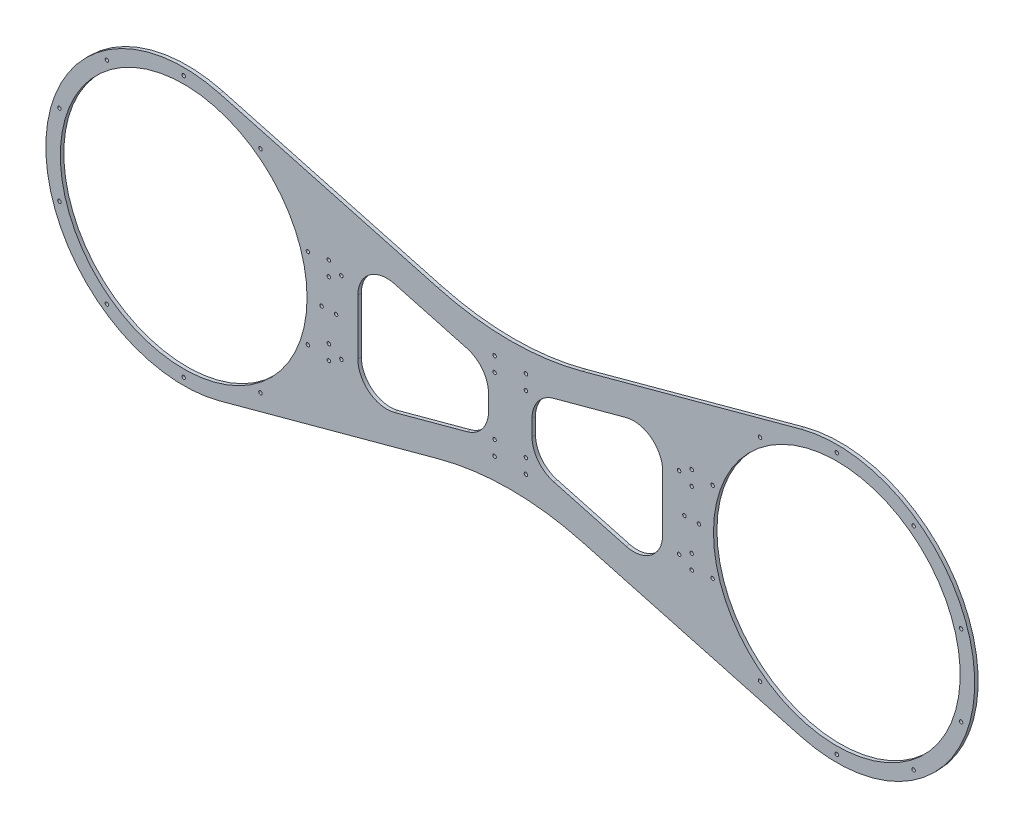
from build123d import *

# Parameters (mm, degrees)
SKETCH1_R           = 425
SKETCH1_R_2         = 6
BOSS_EXTRUDE1_DEPTH = 12
FILLET1_R           = 950
FILLET2_R           = 100


with BuildPart() as part:
    # Sketch1 → Boss-Extrude1 (new body)
    with BuildSketch(Plane.XY):
        with BuildLine():
            Line((-1000.859642854, 458.491190458), (0, 187.5))
            Line((0, 187.5), (0, -187.5))
            Line((0, -187.5), (-1000.859642854, -458.491190458))
            ThreePointArc((-1000.859642854, -458.491190458), (-1600, 0), (-1000.859642854, 458.491190458))
        make_face()
        with Locations((-1125, 0)):
            Circle(SKETCH1_R, mode=Mode.SUBTRACT)
        with Locations((-1125, 450)):
            Circle(SKETCH1_R_2, mode=Mode.SUBTRACT)
        with Locations((-860.496636468, 364.057647469)):
            Circle(SKETCH1_R_2, mode=Mode.SUBTRACT)
        with Locations((-697.024567667, 139.057647469)):
            Circle(SKETCH1_R_2, mode=Mode.SUBTRACT)
        with Locations((-697.024567667, -139.057647469)):
            Circle(SKETCH1_R_2, mode=Mode.SUBTRACT)
        with Locations((-860.496636468, -364.057647469)):
            Circle(SKETCH1_R_2, mode=Mode.SUBTRACT)
        with Locations((-1125, -450)):
            Circle(SKETCH1_R_2, mode=Mode.SUBTRACT)
        with Locations((-1389.503363532, -364.057647469)):
            Circle(SKETCH1_R_2, mode=Mode.SUBTRACT)
        with Locations((-1552.975432333, -139.057647469)):
            Circle(SKETCH1_R_2, mode=Mode.SUBTRACT)
        with Locations((-1552.975432333, 139.057647469)):
            Circle(SKETCH1_R_2, mode=Mode.SUBTRACT)
        with Locations((-1389.503363532, 364.057647469)):
            Circle(SKETCH1_R_2, mode=Mode.SUBTRACT)
        with Locations((-625, 150)):
            Circle(SKETCH1_R_2, mode=Mode.SUBTRACT)
        with Locations((-625, 100)):
            Circle(SKETCH1_R_2, mode=Mode.SUBTRACT)
        with Locations((-581.698729811, 125)):
            Circle(SKETCH1_R_2, mode=Mode.SUBTRACT)
        with Locations(Location((-625, -150, 0), (0, 0, 180))):
            Circle(SKETCH1_R_2, mode=Mode.SUBTRACT)
        with Locations(Location((-581.698729811, -125, 0), (0, 0, 180))):
            Circle(SKETCH1_R_2, mode=Mode.SUBTRACT)
        with Locations(Location((-625, -100, 0), (0, 0, 180))):
            Circle(SKETCH1_R_2, mode=Mode.SUBTRACT)
        with Locations((-600, 0)):
            Circle(SKETCH1_R_2, mode=Mode.SUBTRACT)
        with Locations((-650, 0)):
            Circle(SKETCH1_R_2, mode=Mode.SUBTRACT)
        with Locations((-54, 150)):
            Circle(SKETCH1_R_2, mode=Mode.SUBTRACT)
        with Locations((-54, 100)):
            Circle(SKETCH1_R_2, mode=Mode.SUBTRACT)
        with Locations(Location((-54, -150, 0), (0, 0, 180))):
            Circle(SKETCH1_R_2, mode=Mode.SUBTRACT)
        with Locations(Location((-54, -100, 0), (0, 0, 180))):
            Circle(SKETCH1_R_2, mode=Mode.SUBTRACT)
        Polygon((-75, 104.206200667), (-75, -104.206200667), (-525, -226.047496374), (-525, 226.047496374), align=None, mode=Mode.SUBTRACT)
    boss_extrude1 = extrude(amount=BOSS_EXTRUDE1_DEPTH)

    # Mirror1: Boss-Extrude1 across plane
    add(boss_extrude1.mirror(Plane(origin=(0, -187.5, 12), x_dir=(0, 0, 1), z_dir=(-1, 0, 0))))

    # Fillet1
    fillet1_edges = [part.edges().sort_by_distance(p)[0] for p in [
        (0, 187.5, 6),
        (0, -187.5, 6),
    ]]
    fillet(fillet1_edges, radius=FILLET1_R)

    # Fillet2
    fillet2_edges = [part.edges().sort_by_distance(p)[0] for p in [
        (75, 104.206200667, 6),
        (75, -104.206200667, 6),
        (525, -226.047496374, 6),
        (525, 226.047496374, 6),
        (-75, 104.206200667, 6),
        (-525, 226.047496374, 6),
        (-525, -226.047496374, 6),
        (-75, -104.206200667, 6),
    ]]
    fillet(fillet2_edges, radius=FILLET2_R)


solid = part.part
